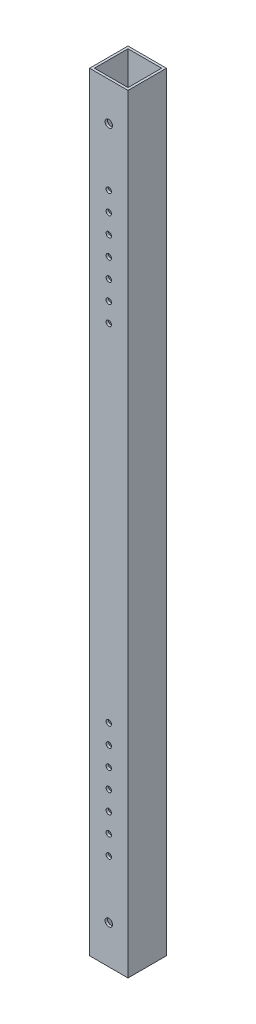
from build123d import *

# Parameters (mm, degrees)
SKETCH1_W                        = 25.4
SKETCH1_H                        = 25.4
SKETCH1_W_2                      = 22.225
SKETCH1_H_2                      = 22.225
BOSS_EXTRUDE1_DEPTH              = 254
F_10_0_1935_DIAMETER_HOLE1_D     = 4.9149
F_10_0_1935_DIAMETER_HOLE1_DEPTH = 50.8
F_10_0_1935_DIAMETER_HOLE1_TIP   = 1.476584928
SKETCH5_R                        = 1.778
CUT_EXTRUDE1_DEPTH               = 256.582569828


with BuildPart() as part:
    # Sketch1 → Boss-Extrude1 (new, symmetric)
    with BuildSketch(Plane(origin=(0, 0, 0), x_dir=(1, 0, 0), z_dir=(0, 1, 0))):
        Rectangle(SKETCH1_W, SKETCH1_H)
        Rectangle(SKETCH1_W_2, SKETCH1_H_2, mode=Mode.SUBTRACT)
    extrude(amount=BOSS_EXTRUDE1_DEPTH, both=True)

    # #10 (0.1935) Diameter Hole1
    with Locations(Plane(origin=(0, 0, -12.7), x_dir=(-1, 0, 0), z_dir=(0, 0, -1))):
        with Locations((0, 228.6), (0, -228.6)):
            Hole(F_10_0_1935_DIAMETER_HOLE1_D / 2, depth=F_10_0_1935_DIAMETER_HOLE1_DEPTH)
            with Locations((0, 0, -(F_10_0_1935_DIAMETER_HOLE1_DEPTH + F_10_0_1935_DIAMETER_HOLE1_TIP / 2))):  # 118° drill point
                Cone(0, F_10_0_1935_DIAMETER_HOLE1_D / 2, F_10_0_1935_DIAMETER_HOLE1_TIP, mode=Mode.SUBTRACT)

    # Sketch5 → Cut-Extrude1 (cut, through all)
    with BuildSketch(Plane.XY.offset(12.7)):
        with Locations((0, 190.5)):
            Circle(SKETCH5_R)
        with Locations((0, 139.7)):
            Circle(SKETCH5_R)
        with Locations((0, 177.8)):
            Circle(SKETCH5_R)
        with Locations((0, 165.1)):
            Circle(SKETCH5_R)
        with Locations((0, 152.4)):
            Circle(SKETCH5_R)
        with Locations((0, 127)):
            Circle(SKETCH5_R)
        with Locations((0, 114.3)):
            Circle(SKETCH5_R)
    cut_extrude1 = extrude(amount=-CUT_EXTRUDE1_DEPTH, mode=Mode.SUBTRACT)

    # Mirror1: Cut-Extrude1 across plane
    add(cut_extrude1.mirror(Plane.ZX), mode=Mode.SUBTRACT)


solid = part.part
